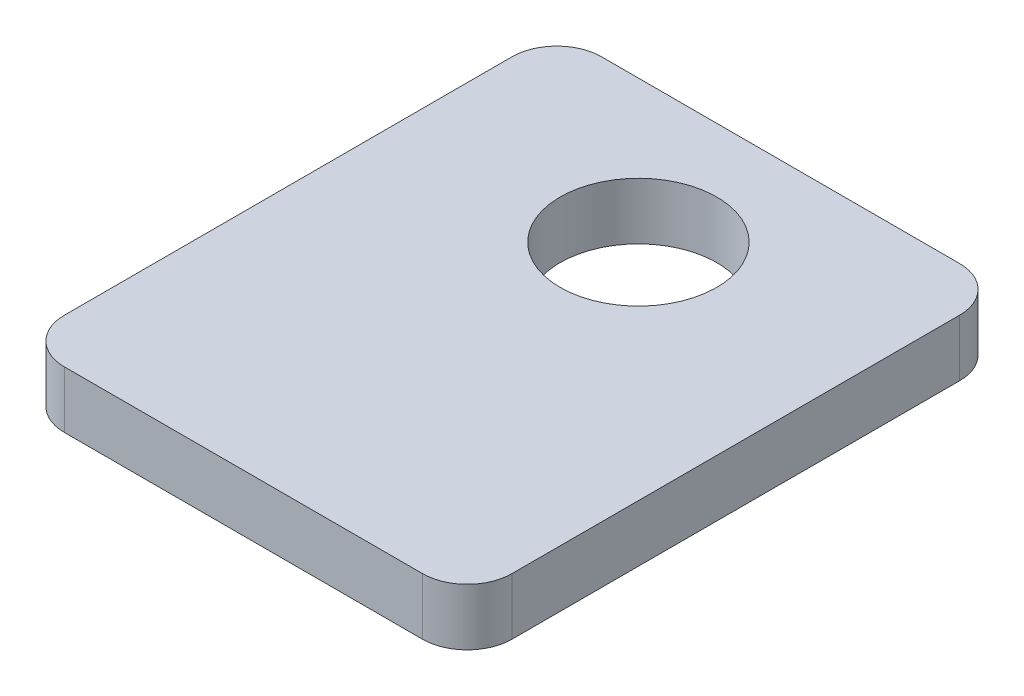
from build123d import *

# Parameters (mm, degrees)
SKETCH1_W           = 10
SKETCH1_H           = 12
SKETCH1_R           = 1.75
BOSS_EXTRUDE1_DEPTH = 1.27
FILLET1_R           = 1


with BuildPart() as part:
    # Sketch1 → Boss-Extrude1 (new body)
    with BuildSketch(Plane(origin=(0, 0, 0), x_dir=(1, 0, 0), z_dir=(0, 1, 0))):
        with Locations((5, -6)):
            Rectangle(SKETCH1_W, SKETCH1_H)
        with Locations(Location((5, -3.175, 0), (0, 0, 270))):
            Circle(SKETCH1_R, mode=Mode.SUBTRACT)
    extrude(amount=BOSS_EXTRUDE1_DEPTH)

    # Fillet1
    fillet1_edges = [part.edges().sort_by_distance(p)[0] for p in [
        (0, 0.635, 0),
        (10, 0.635, 0),
        (10, 0.635, 12),
        (0, 0.635, 12),
    ]]
    fillet(fillet1_edges, radius=FILLET1_R)


solid = part.part
